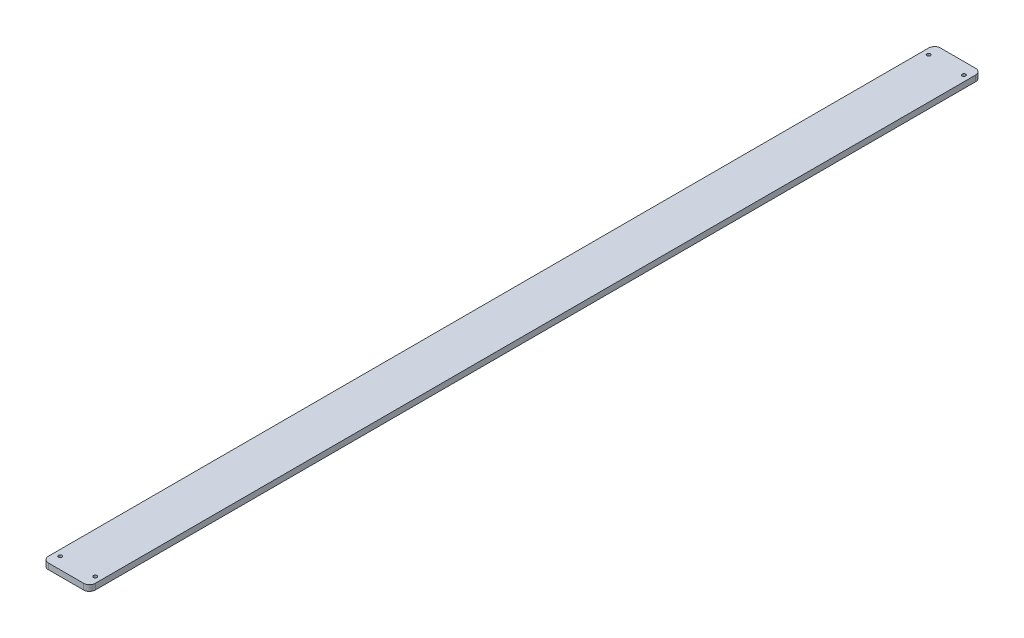
from build123d import *

# Parameters (mm, degrees)
SKETCH_1_W      = 40
SKETCH_1_H      = 761
SKETCH_1_R      = 1.5
EXTRUDE_1_DEPTH = 5
FILLET_1_R      = 5


with BuildPart() as part:
    # ｽｹｯﾁ1 → ﾎﾞｽ - 押し出し1 (new body)
    with BuildSketch(Plane(origin=(0, 0, 0), x_dir=(1, 0, 0), z_dir=(0, 1, 0))):
        Rectangle(SKETCH_1_W, SKETCH_1_H)
        with Locations(Location((15, 370.5, 0), (0, 0, 270))):
            Circle(SKETCH_1_R, mode=Mode.SUBTRACT)
        with Locations(Location((-15, 370.5, 0), (0, 0, 90))):
            Circle(SKETCH_1_R, mode=Mode.SUBTRACT)
        with Locations(Location((-15, -370.5, 0), (0, 0, 270))):
            Circle(SKETCH_1_R, mode=Mode.SUBTRACT)
        with Locations(Location((15, -370.5, 0), (0, 0, 90))):
            Circle(SKETCH_1_R, mode=Mode.SUBTRACT)
    extrude(amount=EXTRUDE_1_DEPTH)

    # ﾌｨﾚｯﾄ1
    fillet_1_edges = [part.edges().sort_by_distance(p)[0] for p in [
        (20, 2.5, 380.5),
        (-20, 2.5, 380.5),
        (-20, 2.5, -380.5),
        (20, 2.5, -380.5),
    ]]
    fillet(fillet_1_edges, radius=FILLET_1_R)


solid = part.part
